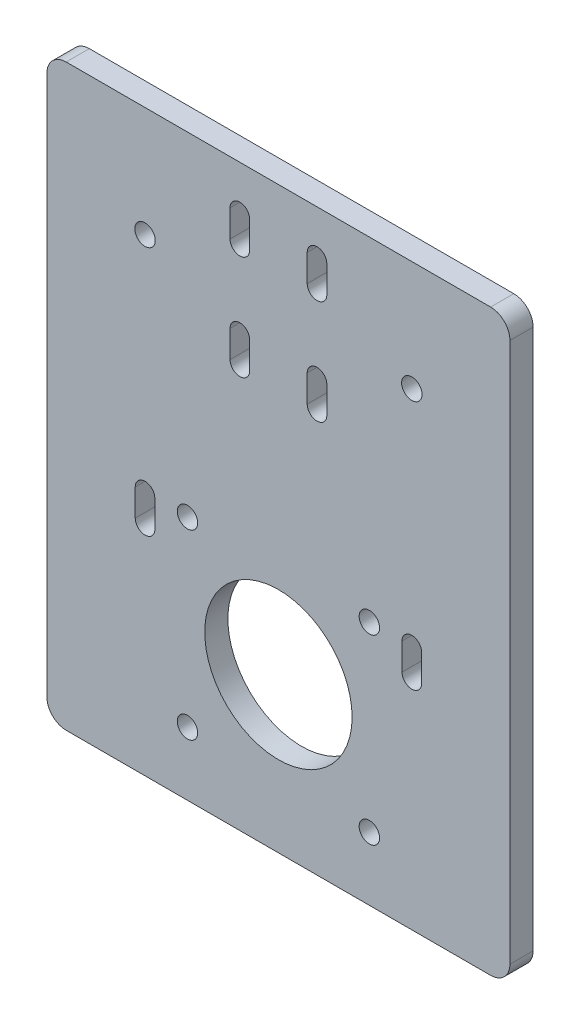
from build123d import *

# Parameters (mm, degrees)
BOSS_EXTRUDE1_DEPTH  = 6
SKETCH4_R            = 19.1
CUT_EXTRUDE1_DEPTH   = 6
M5_CLEARANCE_HOLE1_D = 5.3
CUT_EXTRUDE2_DEPTH   = 6
M5_CLEARANCE_HOLE2_D = 5.3
CUT_EXTRUDE3_DEPTH   = 6


with BuildPart() as part:
    # Sketch3 → Boss-Extrude1 (new body)
    with BuildSketch(Plane.XY):
        with BuildLine():
            Line((-55, -75), (55, -75))
            ThreePointArc((55, -75), (58.535533906, -73.535533906), (60, -70))
            Line((60, -70), (60, 70))
            ThreePointArc((60, 70), (58.535533906, 73.535533906), (55, 75))
            Line((55, 75), (-55, 75))
            ThreePointArc((-55, 75), (-58.535533906, 73.535533906), (-60, 70))
            Line((-60, 70), (-60, -70))
            ThreePointArc((-60, -70), (-58.535533906, -73.535533906), (-55, -75))
        make_face()
    extrude(amount=BOSS_EXTRUDE1_DEPTH)

    # Sketch4 → Cut-Extrude1 (cut)
    with BuildSketch(Plane.XY.offset(6)):
        with Locations((0, -35)):
            Circle(SKETCH4_R)
    extrude(amount=-CUT_EXTRUDE1_DEPTH, mode=Mode.SUBTRACT)

    # M5 Clearance Hole1 (through all)
    with Locations(Plane.XY.offset(6)):
        with Locations((-23.57, -11.43), (23.57, -11.43), (23.57, -58.57), (-23.57, -58.57)):
            Hole(M5_CLEARANCE_HOLE1_D / 2)

    # Sketch7 → Cut-Extrude2 (cut)
    with BuildSketch(Plane.XY.offset(6)):
        with BuildLine():
            Line((-32.03, -11.43), (-32.03, -18.43))
            ThreePointArc((-32.03, -18.43), (-34.57, -20.97), (-37.11, -18.43))
            Line((-37.11, -18.43), (-37.11, -11.43))
            ThreePointArc((-37.11, -11.43), (-34.57, -8.89), (-32.03, -11.43))
        make_face()
        with BuildLine():
            Line((32.03, -11.43), (32.03, -18.43))
            ThreePointArc((32.03, -18.43), (34.57, -20.97), (37.11, -18.43))
            Line((37.11, -18.43), (37.11, -11.43))
            ThreePointArc((37.11, -11.43), (34.57, -8.89), (32.03, -11.43))
        make_face()
    extrude(amount=-CUT_EXTRUDE2_DEPTH, mode=Mode.SUBTRACT)

    # M5 Clearance Hole2 (through all)
    with Locations(Plane.XY.offset(6)):
        with Locations((-34.57, 46.47), (34.57, 46.47)):
            Hole(M5_CLEARANCE_HOLE2_D / 2)

    # Sketch10 → Cut-Extrude3 (cut)
    with BuildSketch(Plane.XY.offset(6)):
        with BuildLine():
            Line((-7.46, 63.5), (-7.46, 56.5))
            ThreePointArc((-7.46, 56.5), (-10, 53.96), (-12.54, 56.5))
            Line((-12.54, 56.5), (-12.54, 63.5))
            ThreePointArc((-12.54, 63.5), (-10, 66.04), (-7.46, 63.5))
        make_face()
        with BuildLine():
            Line((12.54, 63.5), (12.54, 56.5))
            ThreePointArc((12.54, 56.5), (10, 53.96), (7.46, 56.5))
            Line((7.46, 56.5), (7.46, 63.5))
            ThreePointArc((7.46, 63.5), (10, 66.04), (12.54, 63.5))
        make_face()
        with BuildLine():
            Line((-7.46, 29.44), (-7.46, 36.44))
            ThreePointArc((-7.46, 36.44), (-10, 38.98), (-12.54, 36.44))
            Line((-12.54, 36.44), (-12.54, 29.44))
            ThreePointArc((-12.54, 29.44), (-10, 26.9), (-7.46, 29.44))
        make_face()
        with BuildLine():
            Line((12.54, 29.44), (12.54, 36.44))
            ThreePointArc((12.54, 36.44), (10, 38.98), (7.46, 36.44))
            Line((7.46, 36.44), (7.46, 29.44))
            ThreePointArc((7.46, 29.44), (10, 26.9), (12.54, 29.44))
        make_face()
    extrude(amount=-CUT_EXTRUDE3_DEPTH, mode=Mode.SUBTRACT)


solid = part.part
